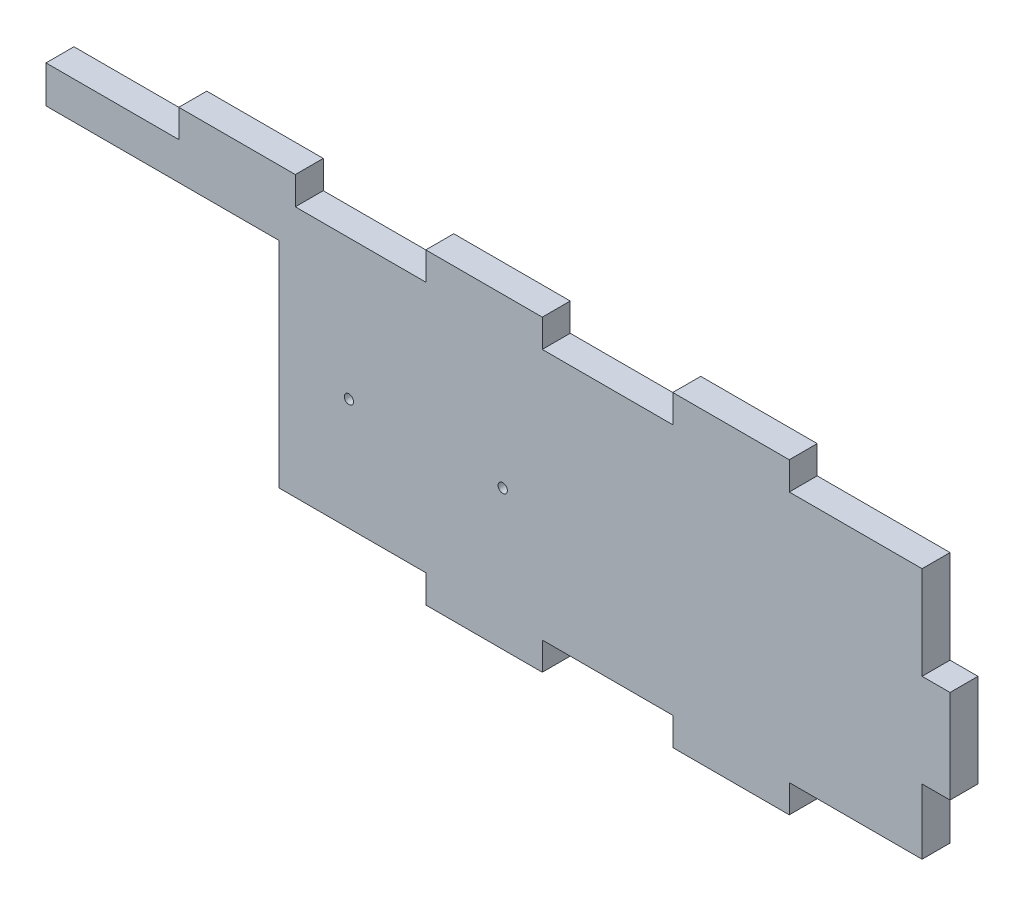
from build123d import *

# Parameters (mm, degrees)
ESQUISSE1_W             = 188
ESQUISSE1_H             = 60
BOSS_EXTRU_1_DEPTH      = 6
ESQUISSE3_W             = 50
ESQUISSE3_H             = 52
ENL_V_MAT_EXTRU_2_DEPTH = 10
ESQUISSE6_W             = 6
ESQUISSE6_H             = 20
BOSS_EXTRU_2_DEPTH      = 6
ESQUISSE7_W             = 25
ESQUISSE7_H             = 6
BOSS_EXTRU_3_DEPTH      = 6
ESQUISSE8_R             = 1
ENL_V_MAT_EXTRU_4_DEPTH = 10
ESQUISSE9_W             = 28.5
ESQUISSE9_H             = 6
ESQUISSE9_W_2           = 28
ESQUISSE9_W_3           = 31.5
ENL_V_MAT_EXTRU_5_DEPTH = 10


with BuildPart() as part:
    # Esquisse1 → Boss.-Extru.1 (new body)
    with BuildSketch(Plane.XY):
        Rectangle(ESQUISSE1_W, ESQUISSE1_H)
    extrude(amount=BOSS_EXTRU_1_DEPTH)

    # Esquisse3 → Enlèv. mat.-Extru.2 (cut)
    with BuildSketch(Plane(origin=(0, 0, 0), x_dir=(-1, 0, 0), z_dir=(0, 0, -1))):
        with Locations((69, -4)):
            Rectangle(ESQUISSE3_W, ESQUISSE3_H)
    extrude(amount=-ENL_V_MAT_EXTRU_2_DEPTH, mode=Mode.SUBTRACT)

    # Esquisse6 → Boss.-Extru.2 (add)
    with BuildSketch(Plane(origin=(94, 0, 0), x_dir=(0, 0, -1), z_dir=(1, 0, 0))):
        with Locations((-3, 0)):
            Rectangle(ESQUISSE6_W, ESQUISSE6_H)
    extrude(amount=BOSS_EXTRU_2_DEPTH)

    # Esquisse7 → Boss.-Extru.3 (add)
    with BuildSketch(Plane(origin=(0, 30, 0), x_dir=(1, 0, 0), z_dir=(0, 1, 0))):
        with Locations((53, -3)):
            Rectangle(ESQUISSE7_W, ESQUISSE7_H)
        with Locations((0, -3)):
            Rectangle(ESQUISSE7_W, ESQUISSE7_H)
        with Locations((-53, -3)):
            Rectangle(ESQUISSE7_W, ESQUISSE7_H)
    extrude(amount=BOSS_EXTRU_3_DEPTH)

    # Esquisse8 → Enlèv. mat.-Extru.4 (cut)
    with BuildSketch(Plane(origin=(0, 0, 0), x_dir=(-1, 0, 0), z_dir=(0, 0, -1))):
        with Locations((29, 0)):
            Circle(ESQUISSE8_R)
        with Locations((-4, 0)):
            Circle(ESQUISSE8_R)
    extrude(amount=-ENL_V_MAT_EXTRU_4_DEPTH, mode=Mode.SUBTRACT)

    # Esquisse9 → Enlèv. mat.-Extru.5 (cut)
    with BuildSketch(Plane(origin=(0, 0, 0), x_dir=(-1, 0, 0), z_dir=(0, 0, -1))):
        with Locations((-79.75, -27)):
            Rectangle(ESQUISSE9_W, ESQUISSE9_H)
        with Locations((-26.5, -27)):
            Rectangle(ESQUISSE9_W_2, ESQUISSE9_H)
        with Locations((28.25, -27)):
            Rectangle(ESQUISSE9_W_3, ESQUISSE9_H)
    extrude(amount=-ENL_V_MAT_EXTRU_5_DEPTH, mode=Mode.SUBTRACT)


solid = part.part
